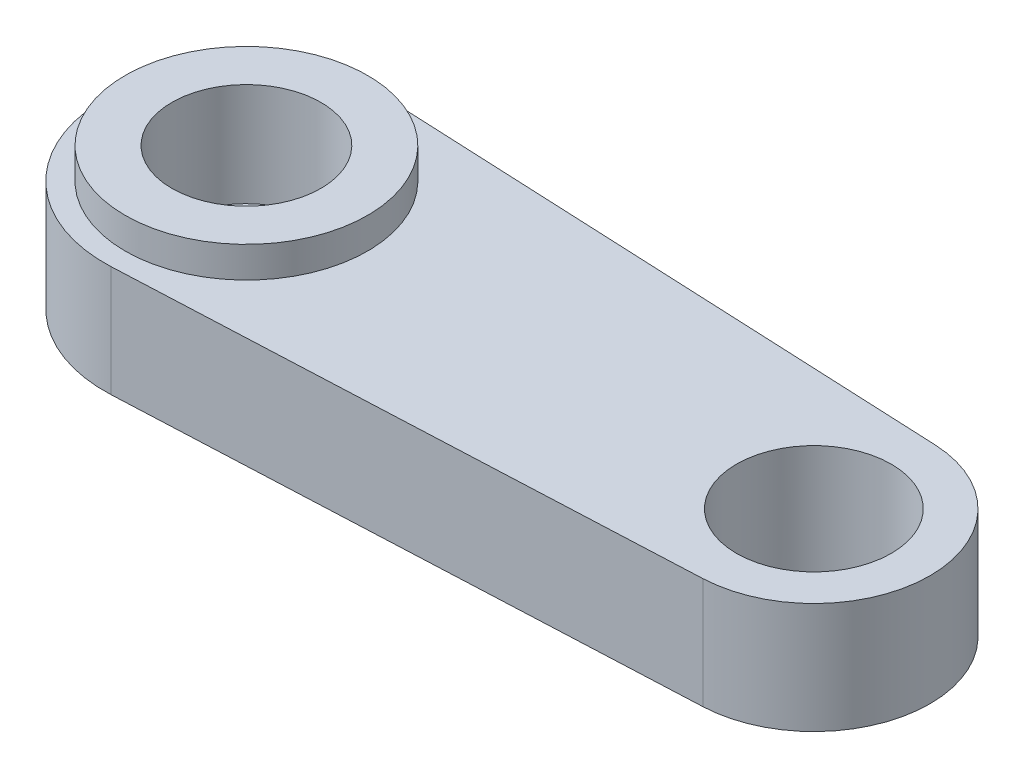
from build123d import *
from build123d.topology import SkipClean

# Parameters (mm, degrees)
SKETCH1_R           = 1.5
SKETCH1_R_2         = 3
BOSS_EXTRUDE1_DEPTH = 3.5
SKETCH2_R           = 4.7
SKETCH2_R_2         = 2.89
BOSS_EXTRUDE2_DEPTH = 3
CUT_EXTRUDE1_START  = -1
SKETCH3_R           = 2.89
CUT_EXTRUDE1_DEPTH  = 1
SKETCH4_R           = 3
SKETCH4_R_2         = 4.7
BOSS_EXTRUDE3_DEPTH = 1.8
CUT_EXTRUDE2_DEPTH  = 1


with BuildPart() as part:
    # Sketch1 → Boss-Extrude1 (new body)
    with BuildSketch(Plane(origin=(0, 0, 0), x_dir=(1, 0, 0), z_dir=(0, 1, 0))):
        with BuildLine():
            Line((0.25, 5.494315244), (22.204545455, 4.495348836))
            ThreePointArc((22.204545455, 4.495348836), (26.5, 0), (22.204545455, -4.495348836))
            Line((22.204545455, -4.495348836), (0.25, -5.494315244))
            ThreePointArc((0.25, -5.494315244), (-5.5, 0), (0.25, 5.494315244))
        make_face()
        with Locations(Location((0, 0, 0), (0, 0, 270))):
            Circle(SKETCH1_R, mode=Mode.SUBTRACT)
        with Locations(Location((22, 0, 0), (0, 0, 270))):
            Circle(SKETCH1_R_2, mode=Mode.SUBTRACT)
    extrude(amount=BOSS_EXTRUDE1_DEPTH)

    # Sketch2 → Boss-Extrude2 (add)
    with BuildSketch(Plane(origin=(0, 3.5, 0), x_dir=(1, 0, 0), z_dir=(0, 1, 0))):
        with Locations(Location((0, 0, 0), (0, 0, 90))):
            Circle(SKETCH2_R)
        with Locations(Location((0, 0, 0), (0, 0, 270))):
            Circle(SKETCH2_R_2, mode=Mode.SUBTRACT)
    extrude(amount=BOSS_EXTRUDE2_DEPTH)

    # Sketch3 → Cut-Extrude1 (cut)
    with BuildSketch(Plane(origin=(0, 3.5, 0), x_dir=(1, 0, 0), z_dir=(0, 1, 0)).offset(CUT_EXTRUDE1_START)):
        with Locations(Location((0, 0, 0), (0, 0, 270))):
            Circle(SKETCH3_R)
    extrude(amount=CUT_EXTRUDE1_DEPTH, mode=Mode.SUBTRACT)

    # Sketch4 → Boss-Extrude3 (add)
    with SkipClean():  # the faces are left unmerged after this step: merging them gives an invalid solid
        with BuildSketch(Plane(origin=(0, 3.5, 0), x_dir=(1, 0, 0), z_dir=(0, 1, 0))):
            with BuildLine():
                Line((0.25, -5.494315244), (22.204545455, -4.495348836))
                ThreePointArc((22.204545455, -4.495348836), (26.5, 0), (22.204545455, 4.495348836))
                Line((22.204545455, 4.495348836), (0.25, 5.494315244))
                ThreePointArc((0.25, 5.494315244), (-5.5, 0), (0.25, -5.494315244))
            make_face()
            with Locations(Location((22, 0, 0), (0, 0, 270))):
                Circle(SKETCH4_R, mode=Mode.SUBTRACT)
            with Locations(Location((0, 0, 0), (0, 0, 270))):
                Circle(SKETCH4_R_2, mode=Mode.SUBTRACT)
        extrude(amount=BOSS_EXTRUDE3_DEPTH)

    # Sketch5 → Cut-Extrude2 (cut)
    with SkipClean():  # the faces are left unmerged after this step: merging them gives an invalid solid
        with BuildSketch(Plane.XZ):
            with BuildLine():
                Line((22.204545455, 4.495348836), (0.25, 5.494315244))
                ThreePointArc((0.25, 5.494315244), (-5.5, 0), (0.25, -5.494315244))
                Line((0.25, -5.494315244), (22.204545455, -4.495348836))
                ThreePointArc((22.204545455, -4.495348836), (26.5, 0), (22.204545455, 4.495348836))
            make_face()
        extrude(amount=-CUT_EXTRUDE2_DEPTH, mode=Mode.SUBTRACT)


solid = part.part
